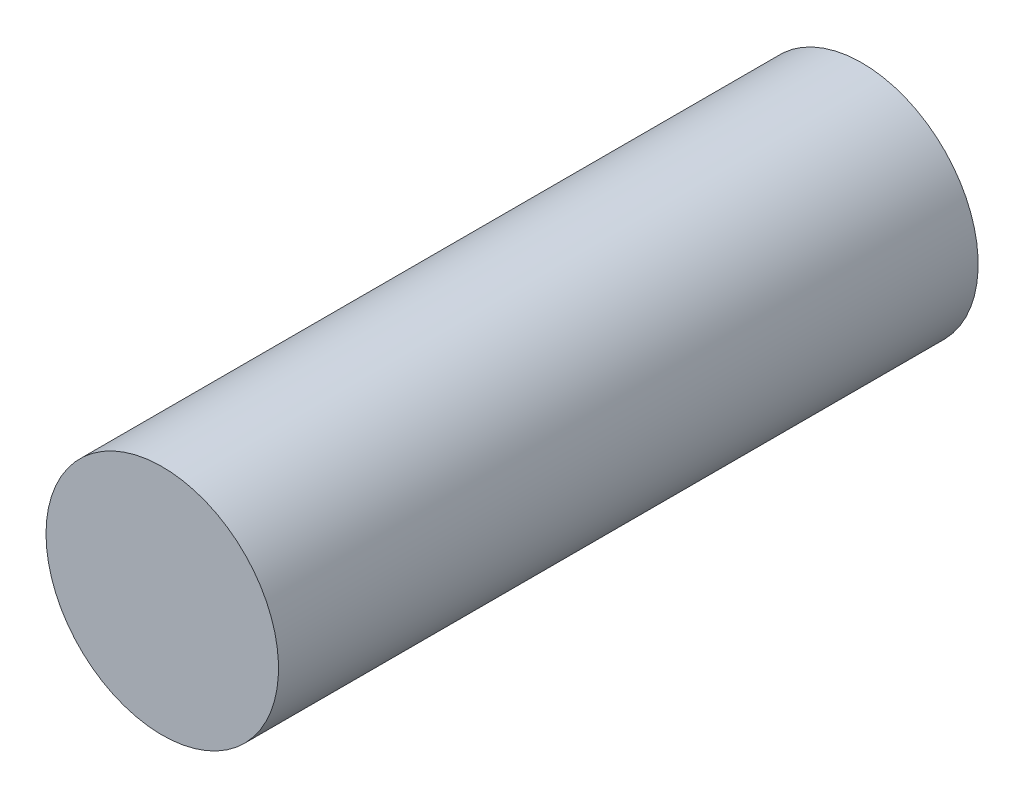
from build123d import *

# Parameters (mm, degrees)
SKETCH1_R           = 12.6619
BOSS_EXTRUDE1_DEPTH = 76.2


with BuildPart() as part:
    # Sketch1 → Boss-Extrude1 (new body)
    with BuildSketch(Plane(origin=(0, 0, 0), x_dir=(0, 1, 0), z_dir=(0, 0, 1))):
        with Locations(Location((0, 0, 0), (0, 0, 90))):
            Circle(SKETCH1_R)
    extrude(amount=BOSS_EXTRUDE1_DEPTH)


solid = part.part
